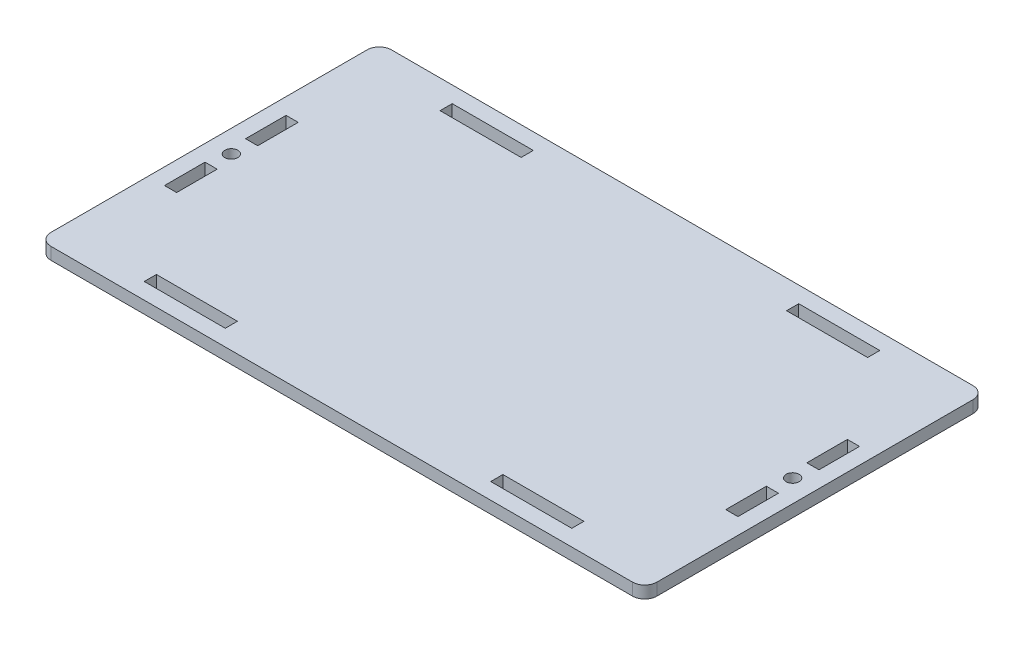
from build123d import *

# Parameters (mm, degrees)
SKETCH1_W           = 149.499999434
SKETCH1_H           = 84
BOSS_EXTRUDE1_DEPTH = 3
SKETCH2_W           = 20
SKETCH2_H           = 3
SKETCH2_W_2         = 3
SKETCH2_H_2         = 10
CUT_EXTRUDE1_DEPTH  = 124.496635409
SKETCH3_R           = 1.6
CUT_EXTRUDE2_DEPTH  = 124.496635409
FILLET1_R           = 3


with BuildPart() as part:
    # Sketch1 → Boss-Extrude1 (new body)
    with BuildSketch(Plane(origin=(0, 0, 0), x_dir=(1, 0, 0), z_dir=(0, 1, 0))):
        with Locations((-40.737898115, -1.645897993)):
            Rectangle(SKETCH1_W, SKETCH1_H)
    extrude(amount=BOSS_EXTRUDE1_DEPTH)

    # Sketch2 → Cut-Extrude1 (cut, through all)
    with BuildSketch(Plane.XZ):
        with Locations((2.012101602, -34.854102007)):
            Rectangle(SKETCH2_W, SKETCH2_H)
        with Locations((-83.487897832, -34.854102007)):
            Rectangle(SKETCH2_W, SKETCH2_H)
        with Locations((-83.487897832, 38.145897993)):
            Rectangle(SKETCH2_W, SKETCH2_H)
        with Locations((2.012101602, 38.145897993)):
            Rectangle(SKETCH2_W, SKETCH2_H)
        with Locations((-109.987897832, 11.645897993)):
            Rectangle(SKETCH2_W_2, SKETCH2_H_2)
        with Locations((-109.987897832, -8.354102007)):
            Rectangle(SKETCH2_W_2, SKETCH2_H_2)
        with Locations((28.512101602, 11.645897993)):
            Rectangle(SKETCH2_W_2, SKETCH2_H_2)
        with Locations((28.512101602, -8.354102007)):
            Rectangle(SKETCH2_W_2, SKETCH2_H_2)
    extrude(amount=-CUT_EXTRUDE1_DEPTH, mode=Mode.SUBTRACT)

    # Sketch3 → Cut-Extrude2 (cut, through all)
    with BuildSketch(Plane.XZ):
        with Locations(Location((28.512101602, 1.645897993, 0), (0, 0, 270))):
            Circle(SKETCH3_R)
        with Locations(Location((-109.987897832, 1.645897993, 0), (0, 0, 270))):
            Circle(SKETCH3_R)
    extrude(amount=-CUT_EXTRUDE2_DEPTH, mode=Mode.SUBTRACT)

    # Fillet1
    fillet1_edges = [part.edges().sort_by_distance(p)[0] for p in [
        (-115.487897832, 1.5, -40.354102007),
        (34.012101602, 1.5, -40.354102007),
        (34.012101602, 1.5, 43.645897993),
        (-115.487897832, 1.5, 43.645897993),
    ]]
    fillet(fillet1_edges, radius=FILLET1_R)


solid = part.part
